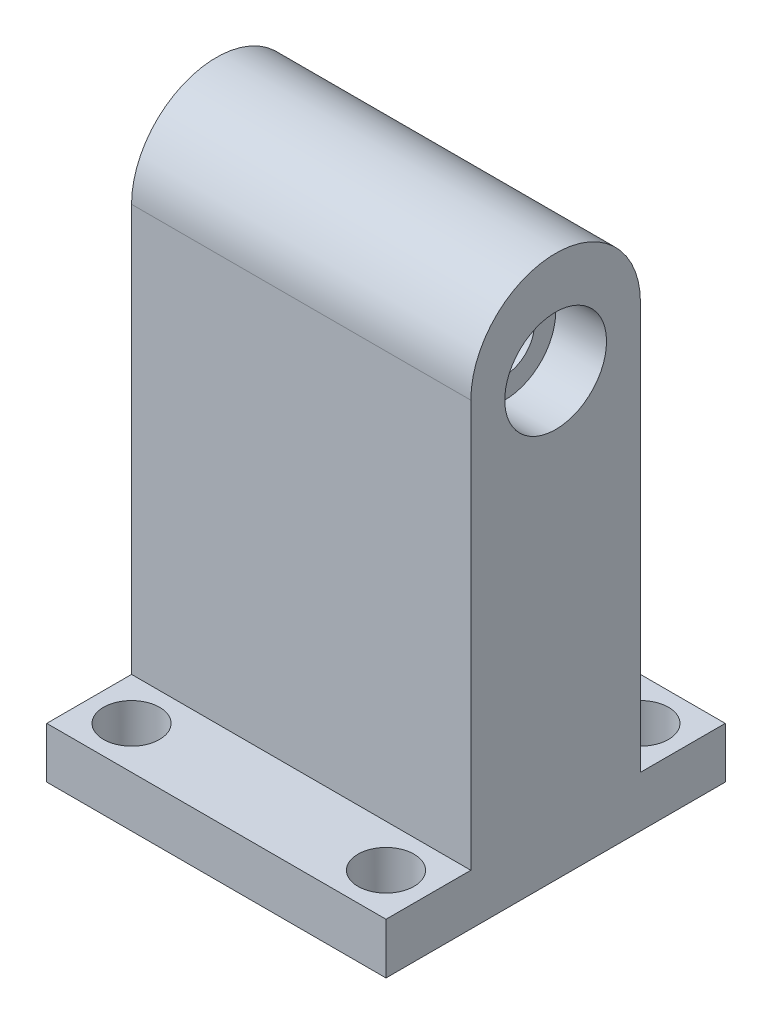
from build123d import *

# Parameters (mm, degrees)
SKETCH1_W           = 20
SKETCH1_H           = 20
BOSS_EXTRUDE1_DEPTH = 36
SKETCH2_R           = 3
CUT_EXTRUDE1_DEPTH  = 3
SKETCH3_R           = 1.75
CUT_EXTRUDE2_DEPTH  = 42.048751504
CUT_EXTRUDE3_START  = -3
SKETCH4_R           = 3
CUT_EXTRUDE3_DEPTH  = 3
SKETCH5_R           = 1.649559613
CUT_EXTRUDE4_DEPTH  = 39.678159212
CUT_EXTRUDE5_DEPTH  = 43.379240201


with BuildPart() as part:
    # Sketch1 → Boss-Extrude1 (new body)
    with BuildSketch(Plane(origin=(0, 0, 0), x_dir=(1, 0, 0), z_dir=(0, 1, 0))):
        Rectangle(SKETCH1_W, SKETCH1_H)
    extrude(amount=BOSS_EXTRUDE1_DEPTH)

    # Sketch2 → Cut-Extrude1 (cut)
    with BuildSketch(Plane(origin=(10, 0, 0), x_dir=(0, 0, -1), z_dir=(1, 0, 0))):
        with Locations((0, 26)):
            Circle(SKETCH2_R)
    extrude(amount=-CUT_EXTRUDE1_DEPTH, mode=Mode.SUBTRACT)

    # Sketch3 → Cut-Extrude2 (cut, through all)
    with BuildSketch(Plane(origin=(7, 0, 0), x_dir=(0, 0, -1), z_dir=(1, 0, 0))):
        with Locations((0, 26)):
            Circle(SKETCH3_R)
    extrude(amount=-CUT_EXTRUDE2_DEPTH, mode=Mode.SUBTRACT)

    # Sketch4 → Cut-Extrude3 (cut)
    with BuildSketch(Plane.ZY.offset(10).offset(CUT_EXTRUDE3_START)):
        with Locations(Location((0, 26, 0), (0, 0, 180))):
            Circle(SKETCH4_R)
    extrude(amount=CUT_EXTRUDE3_DEPTH, mode=Mode.SUBTRACT)

    # Sketch5 → Cut-Extrude4 (cut, through all)
    with BuildSketch(Plane(origin=(0, 36, 0), x_dir=(1, 0, 0), z_dir=(0, 1, 0))):
        with Locations(Location((-7.5, 7.5, 0), (0, 0, 270))):
            Circle(SKETCH5_R)
        with Locations(Location((7.5, 7.5, 0), (0, 0, 270))):
            Circle(SKETCH5_R)
        with Locations(Location((7.5, -7.5, 0), (0, 0, 270))):
            Circle(SKETCH5_R)
        with Locations(Location((-7.5, -7.5, 0), (0, 0, 270))):
            Circle(SKETCH5_R)
    extrude(amount=-CUT_EXTRUDE4_DEPTH, mode=Mode.SUBTRACT)

    # Sketch6 → Cut-Extrude5 (cut, through all)
    with BuildSketch(Plane.ZY.offset(10)):
        with BuildLine():
            Line((-10, 3), (-5, 3))
            Line((-5, 3), (-5, 27))
            ThreePointArc((-5, 27), (0, 32), (5, 27))
            Line((5, 27), (5, 3))
            Line((5, 3), (10, 3))
            Line((10, 3), (10, 36))
            Line((10, 36), (-10, 36))
            Line((-10, 36), (-10, 3))
        make_face()
    extrude(amount=-CUT_EXTRUDE5_DEPTH, mode=Mode.SUBTRACT)


solid = part.part
